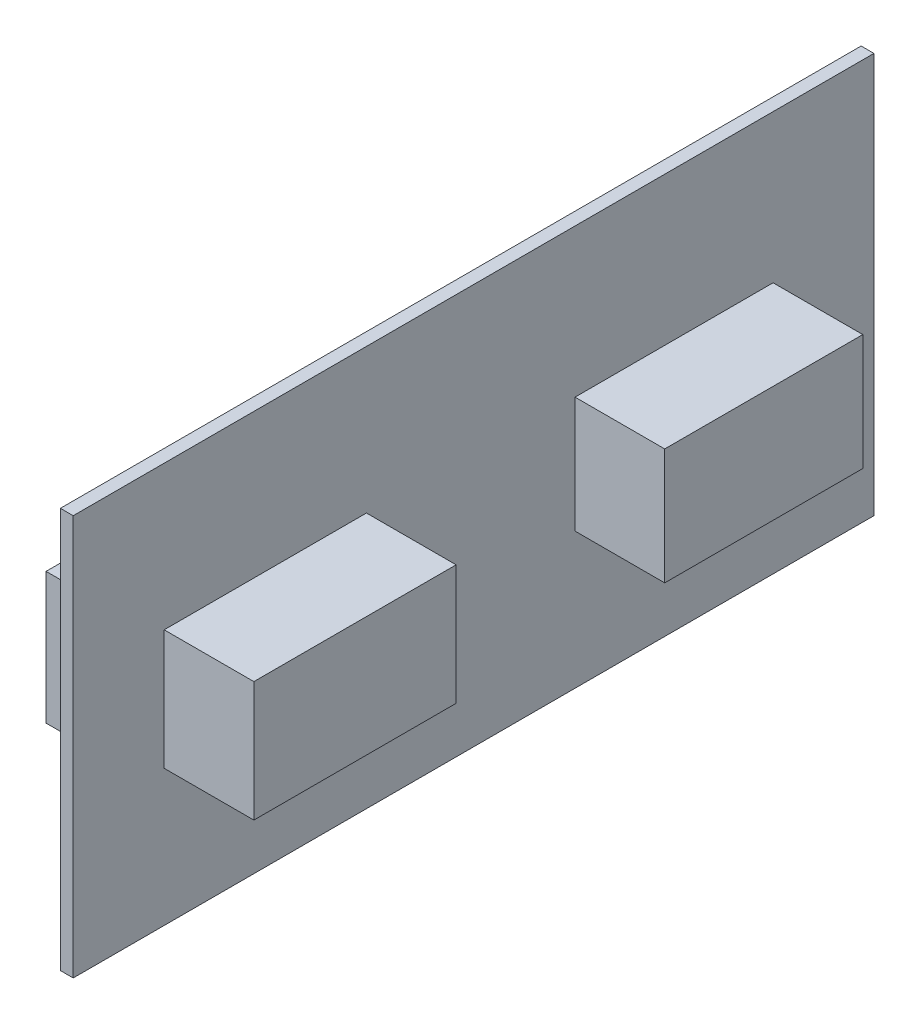
from build123d import *

# Parameters (mm, degrees)
CROQUIS1_W              = 500
CROQUIS1_H              = 250
SALIENTE_EXTRUIR1_DEPTH = 8
CROQUIS2_W              = 126.86716197
CROQUIS2_H              = 82.080673108
CROQUIS2_W_2            = 143.345907008
SALIENTE_EXTRUIR2_DEPTH = 56
CROQUIS4_W              = 126.86716197
CROQUIS4_H              = 82.080673108
SALIENTE_EXTRUIR4_DEPTH = 56
CROQUIS6_W              = 126.300102785
CROQUIS6_H              = 74.898758159
SALIENTE_EXTRUIR5_DEPTH = 56
CROQUIS7_W              = 123.680930687
CROQUIS7_H              = 72.443779117
SALIENTE_EXTRUIR6_DEPTH = 56


with BuildPart() as part:
    # Croquis1 → Saliente-Extruir1 (new body)
    with BuildSketch(Plane(origin=(0, 0, 0), x_dir=(0, 0, -1), z_dir=(1, 0, 0))):
        with Locations((-250, 125)):
            Rectangle(CROQUIS1_W, CROQUIS1_H)
    extrude(amount=SALIENTE_EXTRUIR1_DEPTH)

    # Croquis2 → Saliente-Extruir2 (add)
    with BuildSketch(Plane.ZY):
        with Locations((119.573923975, 123.338686018)):
            Rectangle(CROQUIS2_W, CROQUIS2_H)
        with Locations((381.283910617, 123.338686018)):
            Rectangle(CROQUIS2_W_2, CROQUIS2_H)
    extrude(amount=SALIENTE_EXTRUIR2_DEPTH)

    # Croquis4 → Saliente-Extruir4 (add)
    with BuildSketch(Plane.ZY):
        with Locations((119.573923975, 123.338686018)):
            Rectangle(CROQUIS4_W, CROQUIS4_H)
    extrude(amount=SALIENTE_EXTRUIR4_DEPTH)

    # Croquis6 → Saliente-Extruir5 (add)
    with BuildSketch(Plane(origin=(8, 0, 0), x_dir=(0, 0, -1), z_dir=(1, 0, 0))):
        with Locations((-380.044849003, 122.441200165)):
            Rectangle(CROQUIS6_W, CROQUIS6_H)
    extrude(amount=SALIENTE_EXTRUIR5_DEPTH)

    # Croquis7 → Saliente-Extruir6 (add)
    with BuildSketch(Plane(origin=(8, 0, 0), x_dir=(0, 0, -1), z_dir=(1, 0, 0))):
        with Locations((-124.804336035, 121.213710644)):
            Rectangle(CROQUIS7_W, CROQUIS7_H)
    extrude(amount=SALIENTE_EXTRUIR6_DEPTH)


solid = part.part
